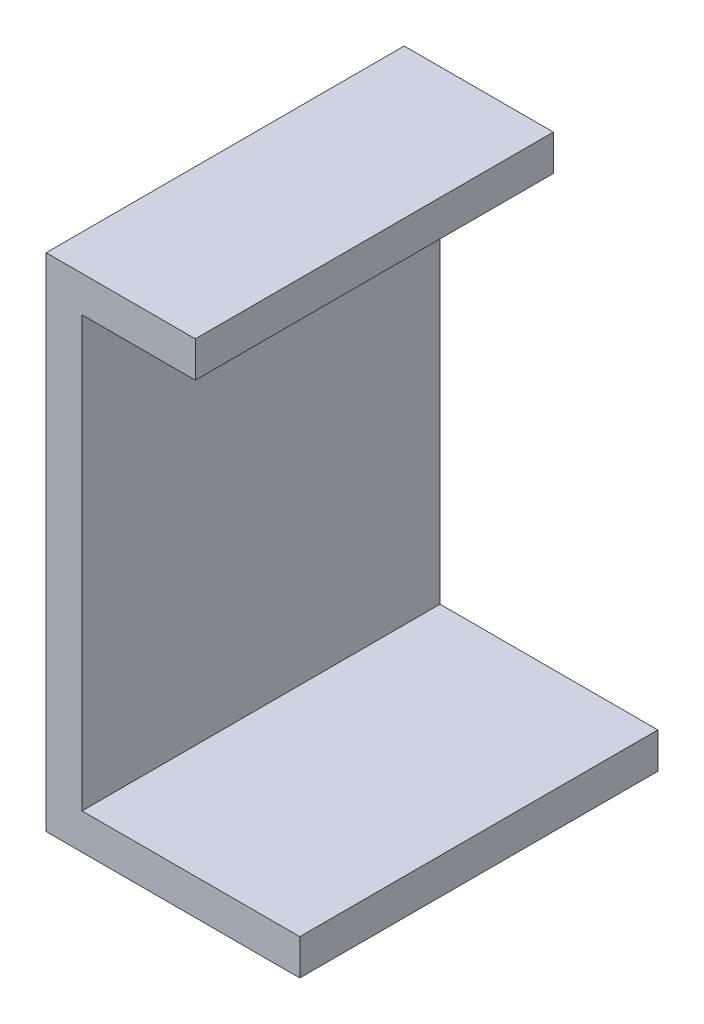
from build123d import *

# Parameters (mm, degrees)
SKETCH1_W           = 18.250795329
SKETCH1_H           = 3
BOSS_EXTRUDE1_DEPTH = 15


with BuildPart() as part:
    # Sketch1 → Boss-Extrude1 (new, symmetric)
    with BuildSketch(Plane.XY):
        Polygon((3, 0), (0, 0), (0, 42), (12.496402878, 42), (12.496402878, 39), (3, 39), align=None)
        with Locations((12.125397665, 1.5)):
            Rectangle(SKETCH1_W, SKETCH1_H)
    extrude(amount=BOSS_EXTRUDE1_DEPTH, both=True)


solid = part.part
